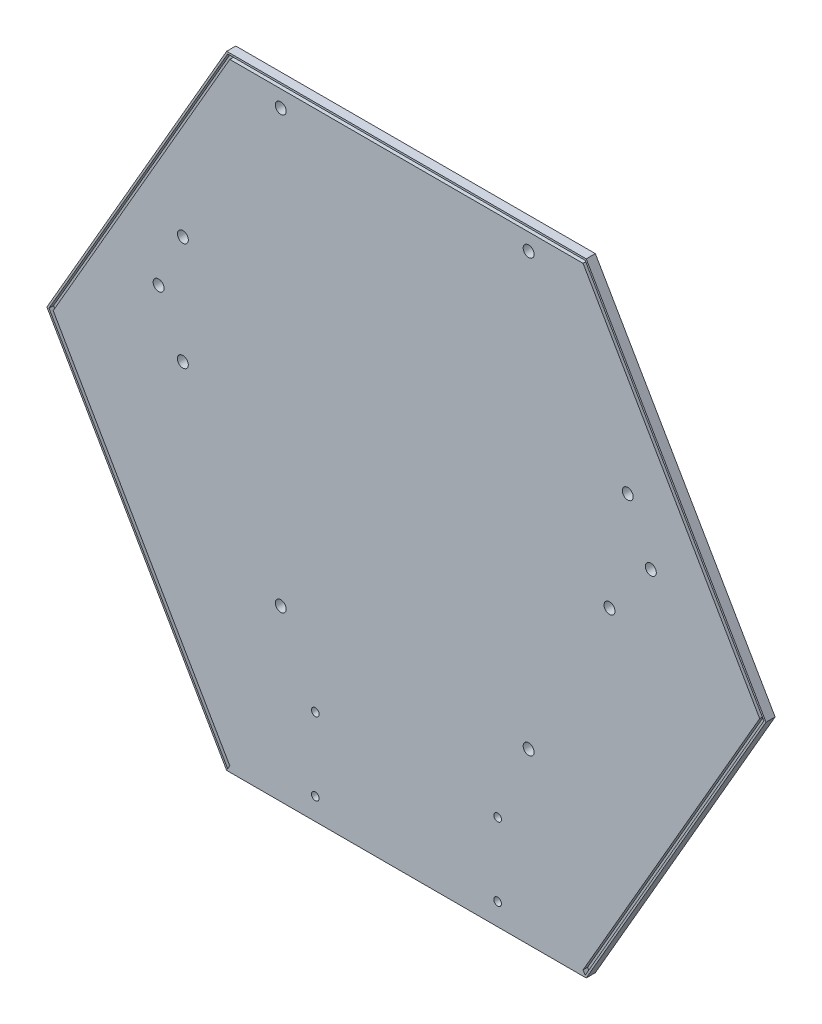
from build123d import *

# Parameters (mm, degrees)
EXTRUDE_9_DEPTH      = 5
CUT_EXTRUDE_7_DEPTH  = 2.5
SKETCH_53_R          = 3
CUT_EXTRUDE_12_DEPTH = 5
SKETCH_54_R          = 2.1
CUT_EXTRUDE_14_DEPTH = 291.088033153


with BuildPart() as part:
    # 草图51 → 凸台-拉伸9 (new body)
    with BuildSketch(Plane.XY.offset(20)):
        Polygon((198.176593222, -40.983726982), (99.565497293, 129.815701356), (-97.656694564, 129.815701356), (-196.267790492, -40.983726982), (-97.656694564, -211.78315532), (99.565497293, -211.78315532), align=None)
    extrude(amount=EXTRUDE_9_DEPTH)

    # 草图52 → 切除-拉伸7 (cut)
    with BuildSketch(Plane.XY.offset(25)):
        Polygon((-195.113089954, -40.983726982), (-97.079344294, 128.815701356), (98.988147024, 128.815701356), (197.021892683, -40.983726982), (98.988147024, -210.78315532), (97.833446486, -208.78315532), (194.712491607, -40.983726982), (97.833446486, 126.815701356), (-95.924643756, 126.815701356), (-192.803688877, -40.983726982), (-95.924643756, -208.78315532), (-97.079344294, -210.78315532), align=None)
    extrude(amount=-CUT_EXTRUDE_7_DEPTH, mode=Mode.SUBTRACT)

    # 草图53 → 切除-拉伸12 (cut)
    with BuildSketch(Plane(origin=(0, 0, 20), x_dir=(-1, 0, 0), z_dir=(0, 0, -1))):
        with Locations((-67.98, -118.86)):
            Circle(SKETCH_53_R)
        with Locations((-67.98, 117.66)):
            Circle(SKETCH_53_R)
        with Locations((67.98, 117.66)):
            Circle(SKETCH_53_R)
        with Locations((-112.33, -29.68)):
            Circle(SKETCH_53_R)
        with Locations((121.69, -29.68)):
            Circle(SKETCH_53_R)
        with Locations((-135, 0)):
            Circle(SKETCH_53_R)
        with Locations((135, 0)):
            Circle(SKETCH_53_R)
        with Locations((-122.33, 29.64)):
            Circle(SKETCH_53_R)
        with Locations((121.69, 29.64)):
            Circle(SKETCH_53_R)
        with Locations((67.98, -118.86)):
            Circle(SKETCH_53_R)
    extrude(amount=-CUT_EXTRUDE_12_DEPTH, mode=Mode.SUBTRACT)

    # 草图54 → 切除-拉伸14 (cut, through all)
    with BuildSketch(Plane.XY.offset(20)):
        with Locations((-49.045598635, -199.78315532)):
            Circle(SKETCH_54_R)
        with Locations(Location((50.954401365, -199.78315532, 0), (0, 0, 180))):
            Circle(SKETCH_54_R)
        with Locations((-49.045598635, -159.78315532)):
            Circle(SKETCH_54_R)
        with Locations(Location((50.954401365, -159.78315532, 0), (0, 0, 180))):
            Circle(SKETCH_54_R)
    extrude(amount=CUT_EXTRUDE_14_DEPTH, mode=Mode.SUBTRACT)


solid = part.part
